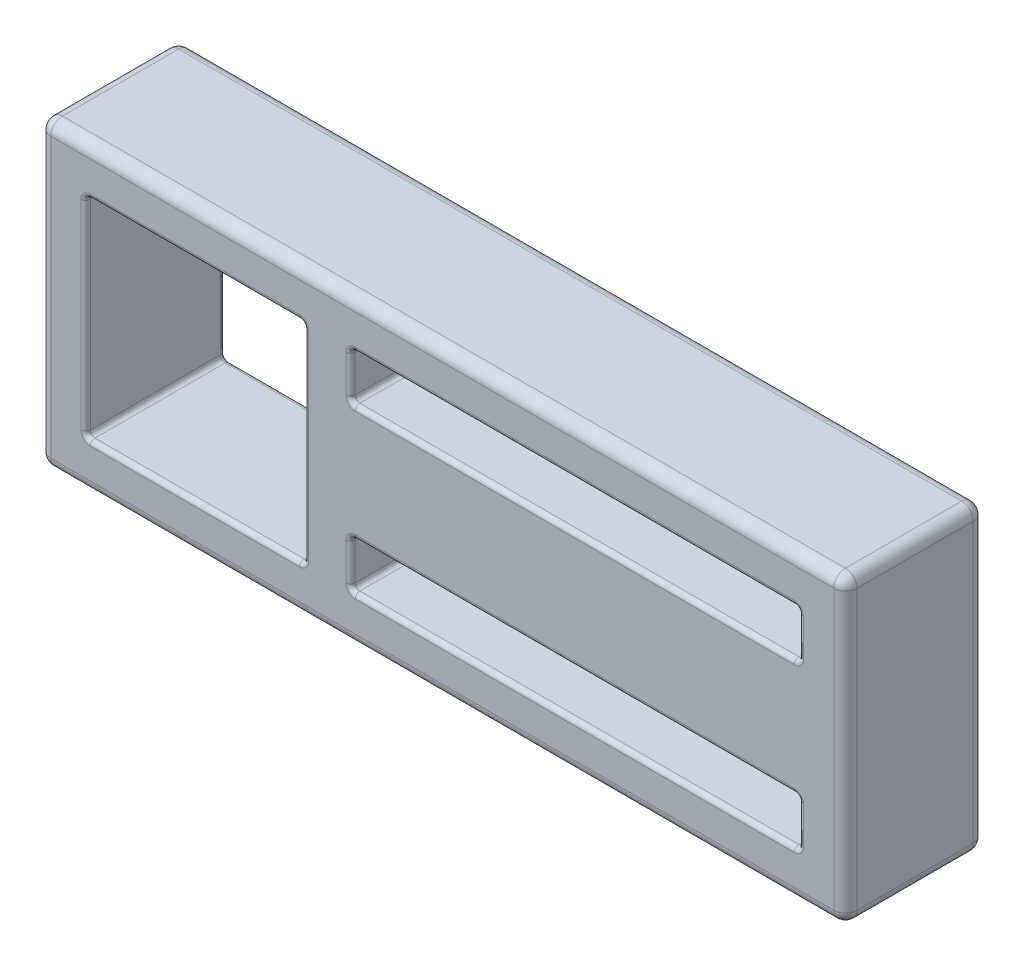
from build123d import *

# Parameters (mm, degrees)
SKETCH1_W           = 44.069
SKETCH1_H           = 16.51
SKETCH1_W_2         = 24.511
SKETCH1_H_2         = 2.54
SKETCH1_W_3         = 11.938
SKETCH1_H_3         = 11.43
BOSS_EXTRUDE1_DEPTH = 7.62
FILLET1_R           = 0.635
FILLET2_R           = 0.254


with BuildPart() as part:
    # Sketch1 → Boss-Extrude1 (new body)
    with BuildSketch(Plane.XY):
        with Locations((22.0345, 8.255)):
            Rectangle(SKETCH1_W, SKETCH1_H)
        with Locations((29.2735, 12.7)):
            Rectangle(SKETCH1_W_2, SKETCH1_H_2, mode=Mode.SUBTRACT)
        with Locations((8.509, 8.255)):
            Rectangle(SKETCH1_W_3, SKETCH1_H_3, mode=Mode.SUBTRACT)
        with Locations((29.2735, 3.81)):
            Rectangle(SKETCH1_W_2, SKETCH1_H_2, mode=Mode.SUBTRACT)
    extrude(amount=BOSS_EXTRUDE1_DEPTH)

    # Fillet1
    fillet1_edges = [part.edges().sort_by_distance(p)[0] for p in [
        (44.069, 8.255, 7.62),
        (22.0345, 16.51, 7.62),
        (0, 8.255, 7.62),
        (22.0345, 16.51, 0),
        (44.069, 8.255, 0),
        (22.0345, 0, 0),
        (0, 8.255, 0),
        (22.0345, 0, 7.62),
        (0, 16.51, 3.81),
        (44.069, 16.51, 3.81),
        (44.069, 0, 3.81),
        (0, 0, 3.81),
    ]]
    fillet(fillet1_edges, radius=FILLET1_R)

    # Fillet2
    fillet2_edges = [part.edges().sort_by_distance(p)[0] for p in [
        (2.54, 8.255, 0),
        (2.54, 13.97, 3.81),
        (8.509, 2.54, 0),
        (2.54, 2.54, 3.81),
        (14.478, 8.255, 0),
        (14.478, 2.54, 3.81),
        (8.509, 13.97, 0),
        (14.478, 13.97, 3.81),
        (2.54, 8.255, 7.62),
        (8.509, 2.54, 7.62),
        (14.478, 8.255, 7.62),
        (8.509, 13.97, 7.62),
        (17.018, 3.81, 0),
        (17.018, 5.08, 3.81),
        (29.2735, 2.54, 0),
        (17.018, 2.54, 3.81),
        (41.529, 3.81, 0),
        (41.529, 2.54, 3.81),
        (29.2735, 5.08, 0),
        (41.529, 5.08, 3.81),
        (17.018, 3.81, 7.62),
        (29.2735, 2.54, 7.62),
        (41.529, 3.81, 7.62),
        (29.2735, 5.08, 7.62),
        (17.018, 12.7, 0),
        (17.018, 13.97, 3.81),
        (29.2735, 11.43, 0),
        (17.018, 11.43, 3.81),
        (41.529, 12.7, 0),
        (41.529, 11.43, 3.81),
        (29.2735, 13.97, 0),
        (41.529, 13.97, 3.81),
        (17.018, 12.7, 7.62),
        (29.2735, 11.43, 7.62),
        (41.529, 12.7, 7.62),
        (29.2735, 13.97, 7.62),
    ]]
    fillet(fillet2_edges, radius=FILLET2_R)


solid = part.part
